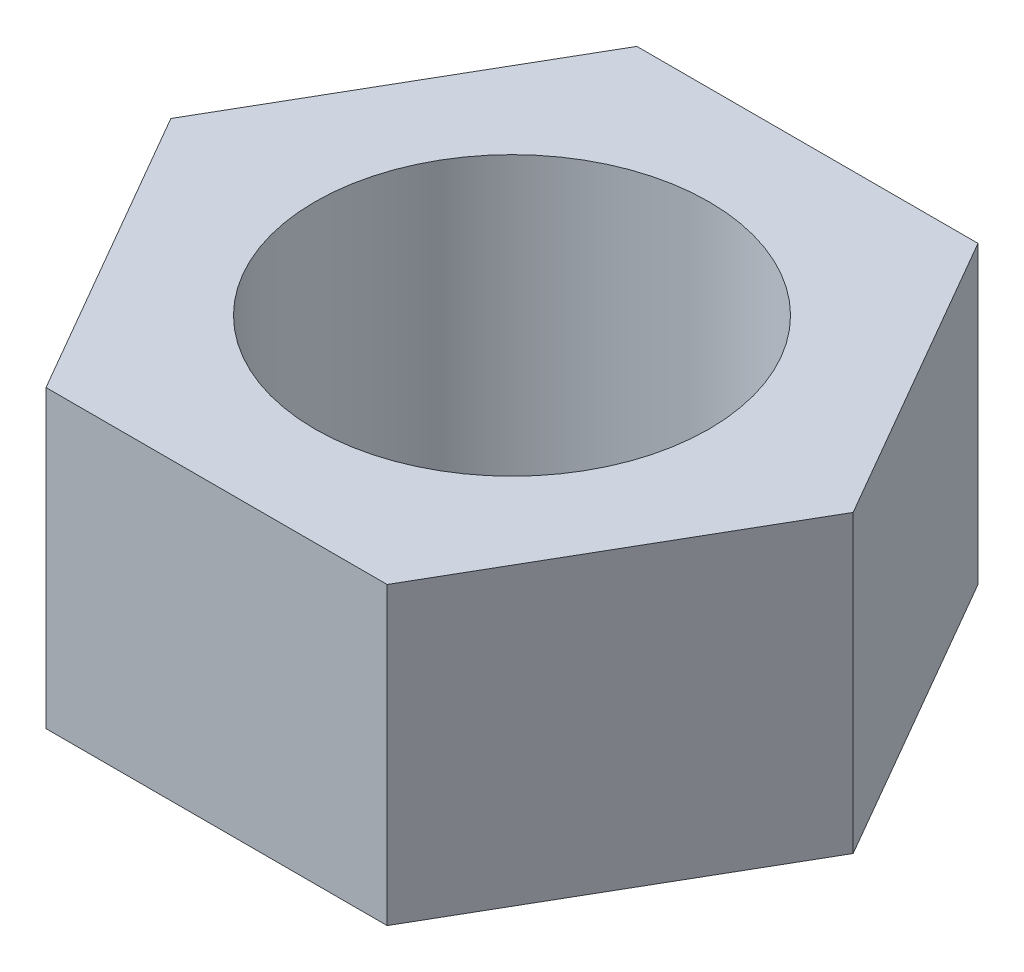
from build123d import *

# Parameters (mm, degrees)
SKETCH1_R           = 1
BOSS_EXTRUDE1_DEPTH = 1.5


with BuildPart() as part:
    # Sketch1 → Boss-Extrude1 (new body)
    with BuildSketch(Plane(origin=(0, 0, 0), x_dir=(1, 0, 0), z_dir=(0, 1, 0))):
        Polygon((-1.732050808, 0), (-0.866025404, -1.5), (0.866025404, -1.5), (1.732050808, 0), (0.866025404, 1.5), (-0.866025404, 1.5), align=None)
        with Locations(Location((0, 0, 0), (0, 0, 270))):
            Circle(SKETCH1_R, mode=Mode.SUBTRACT)
    extrude(amount=BOSS_EXTRUDE1_DEPTH)


solid = part.part
